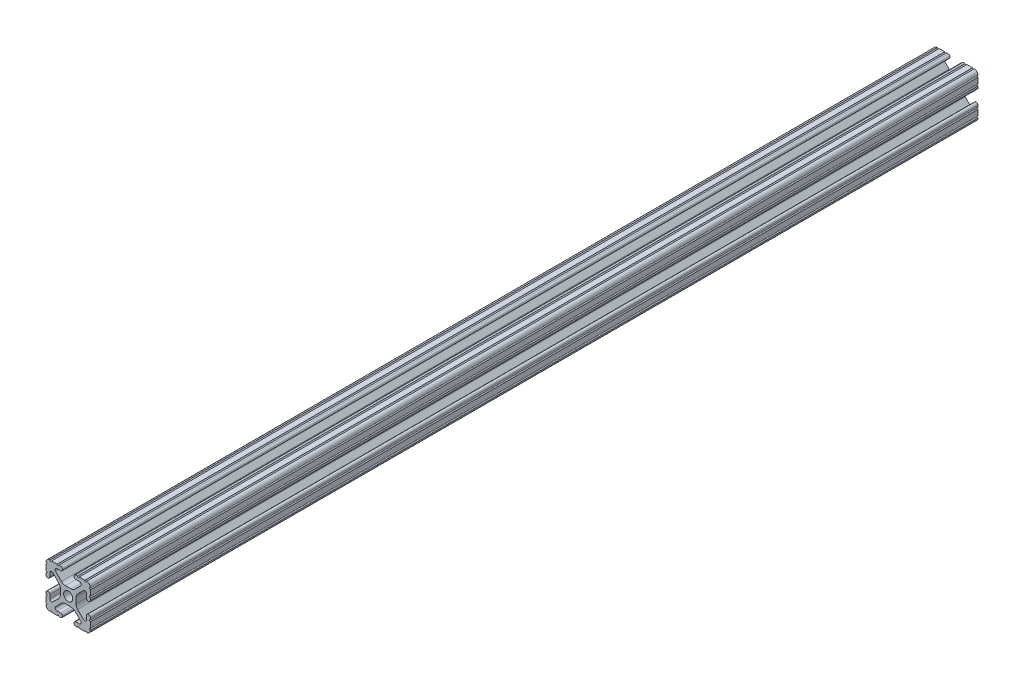
from build123d import *

# Parameters (mm, degrees)
SKETCH1_R           = 2.6035
BOSS_EXTRUDE1_DEPTH = 508


with BuildPart() as part:
    # Sketch1 → Boss-Extrude1 (new body)
    with BuildSketch(Plane(origin=(0, 0, -25.4), x_dir=(-1, 0, 0), z_dir=(0, 0, -1))):
        with BuildLine():
            Line((12.7, -9.5504), (12.7, -6.3330836))
            ThreePointArc((12.7, -6.3330836), (12.192, -5.8250836), (12.7, -5.3170836))
            Line((12.7, -5.3170836), (12.7, -4.3434))
            ThreePointArc((12.7, -4.3434), (11.5951, -3.2385), (10.4902, -4.3434))
            Line((10.4902, -4.3434), (10.4902, -6.474794456))
            ThreePointArc((10.4902, -6.474794456), (9.863006367, -7.413456061), (8.75577951, -7.193214945))
            Line((8.75577951, -7.193214945), (5.42573597, -3.863171405))
            ThreePointArc((5.42573597, -3.863171405), (4.737482484, -2.833127272), (4.4958, -1.618107374))
            Line((4.4958, -1.618107374), (4.4958, 1.618107374))
            ThreePointArc((4.4958, 1.618107374), (4.737482484, 2.833127272), (5.42573597, 3.863171405))
            Line((5.42573597, 3.863171405), (8.75577951, 7.193214945))
            ThreePointArc((8.75577951, 7.193214945), (9.863006367, 7.413456061), (10.4902, 6.474794456))
            Line((10.4902, 6.474794456), (10.4902, 4.343399971))
            ThreePointArc((10.4902, 4.343399971), (11.5951, 3.238499971), (12.7, 4.343399971))
            Line((12.7, 4.343399971), (12.7, 5.3170836))
            ThreePointArc((12.7, 5.3170836), (12.192, 5.8250836), (12.7, 6.3330836))
            Line((12.7, 6.3330836), (12.7, 9.5504))
            ThreePointArc((12.7, 9.5504), (12.192000006, 10.058323491), (12.699846982, 10.566399977))
            ThreePointArc((12.699846982, 10.566399977), (12.082522516, 12.082522516), (10.566399977, 12.699846982))
            ThreePointArc((10.566399977, 12.699846982), (10.058323491, 12.192000006), (9.5504, 12.7))
            Line((9.5504, 12.7), (6.3330836, 12.7))
            ThreePointArc((6.3330836, 12.7), (5.8250836, 12.192), (5.3170836, 12.7))
            Line((5.3170836, 12.7), (4.3434, 12.7))
            ThreePointArc((4.3434, 12.7), (3.2385, 11.5951), (4.3434, 10.4902))
            Line((4.3434, 10.4902), (6.474794456, 10.4902))
            ThreePointArc((6.474794456, 10.4902), (7.413456061, 9.863006367), (7.193214945, 8.75577951))
            Line((7.193214945, 8.75577951), (3.863171405, 5.42573597))
            ThreePointArc((3.863171405, 5.42573597), (2.833127272, 4.737482484), (1.618107374, 4.4958))
            Line((1.618107374, 4.4958), (-1.618107374, 4.4958))
            ThreePointArc((-1.618107374, 4.4958), (-2.833127272, 4.737482484), (-3.863171405, 5.42573597))
            Line((-3.863171405, 5.42573597), (-7.193214945, 8.75577951))
            ThreePointArc((-7.193214945, 8.75577951), (-7.413456061, 9.863006367), (-6.474794456, 10.4902))
            Line((-6.474794456, 10.4902), (-4.343399971, 10.4902))
            ThreePointArc((-4.343399971, 10.4902), (-3.238499971, 11.5951), (-4.343399971, 12.7))
            Line((-4.343399971, 12.7), (-5.3170836, 12.7))
            ThreePointArc((-5.3170836, 12.7), (-5.8250836, 12.192), (-6.3330836, 12.7))
            Line((-6.3330836, 12.7), (-9.5504, 12.7))
            ThreePointArc((-9.5504, 12.7), (-10.058323491, 12.192000006), (-10.566399977, 12.699846982))
            ThreePointArc((-10.566399977, 12.699846982), (-12.082522516, 12.082522516), (-12.699846982, 10.566399977))
            ThreePointArc((-12.699846982, 10.566399977), (-12.192000006, 10.058323491), (-12.7, 9.5504))
            Line((-12.7, 9.5504), (-12.7, 6.3330836))
            ThreePointArc((-12.7, 6.3330836), (-12.192, 5.8250836), (-12.7, 5.3170836))
            Line((-12.7, 5.3170836), (-12.7, 4.3434))
            ThreePointArc((-12.7, 4.3434), (-11.5951, 3.2385), (-10.4902, 4.3434))
            Line((-10.4902, 4.3434), (-10.4902, 6.474794456))
            ThreePointArc((-10.4902, 6.474794456), (-9.863006367, 7.413456061), (-8.75577951, 7.193214945))
            Line((-8.75577951, 7.193214945), (-5.42573597, 3.863171405))
            ThreePointArc((-5.42573597, 3.863171405), (-4.737482484, 2.833127272), (-4.4958, 1.618107374))
            Line((-4.4958, 1.618107374), (-4.4958, -1.618107374))
            ThreePointArc((-4.4958, -1.618107374), (-4.737482484, -2.833127272), (-5.42573597, -3.863171405))
            Line((-5.42573597, -3.863171405), (-8.75577951, -7.193214945))
            ThreePointArc((-8.75577951, -7.193214945), (-9.863006367, -7.413456061), (-10.4902, -6.474794456))
            Line((-10.4902, -6.474794456), (-10.4902, -4.343399971))
            ThreePointArc((-10.4902, -4.343399971), (-11.5951, -3.238499971), (-12.7, -4.343399971))
            Line((-12.7, -4.343399971), (-12.7, -5.3170836))
            ThreePointArc((-12.7, -5.3170836), (-12.192, -5.8250836), (-12.7, -6.3330836))
            Line((-12.7, -6.3330836), (-12.7, -9.5504))
            ThreePointArc((-12.7, -9.5504), (-12.192000006, -10.058323491), (-12.699846982, -10.566399977))
            ThreePointArc((-12.699846982, -10.566399977), (-12.082522516, -12.082522516), (-10.566399977, -12.699846982))
            ThreePointArc((-10.566399977, -12.699846982), (-10.058323491, -12.192000006), (-9.5504, -12.7))
            Line((-9.5504, -12.7), (-6.3330836, -12.7))
            ThreePointArc((-6.3330836, -12.7), (-5.8250836, -12.192), (-5.3170836, -12.7))
            Line((-5.3170836, -12.7), (-4.3434, -12.7))
            ThreePointArc((-4.3434, -12.7), (-3.2385, -11.5951), (-4.3434, -10.4902))
            Line((-4.3434, -10.4902), (-6.474794456, -10.4902))
            ThreePointArc((-6.474794456, -10.4902), (-7.413456061, -9.863006367), (-7.193214945, -8.75577951))
            Line((-7.193214945, -8.75577951), (-3.863171405, -5.42573597))
            ThreePointArc((-3.863171405, -5.42573597), (-2.833127272, -4.737482484), (-1.618107374, -4.4958))
            Line((-1.618107374, -4.4958), (1.618107374, -4.4958))
            ThreePointArc((1.618107374, -4.4958), (2.833127272, -4.737482484), (3.863171405, -5.42573597))
            Line((3.863171405, -5.42573597), (7.193214945, -8.75577951))
            ThreePointArc((7.193214945, -8.75577951), (7.413456061, -9.863006367), (6.474794456, -10.4902))
            Line((6.474794456, -10.4902), (4.343399971, -10.4902))
            ThreePointArc((4.343399971, -10.4902), (3.238499971, -11.5951), (4.343399971, -12.7))
            Line((4.343399971, -12.7), (5.3170836, -12.7))
            ThreePointArc((5.3170836, -12.7), (5.8250836, -12.192), (6.3330836, -12.7))
            Line((6.3330836, -12.7), (9.5504, -12.7))
            ThreePointArc((9.5504, -12.7), (10.058323491, -12.192000006), (10.566399977, -12.699846982))
            ThreePointArc((10.566399977, -12.699846982), (12.082522516, -12.082522516), (12.699846982, -10.566399977))
            ThreePointArc((12.699846982, -10.566399977), (12.192000006, -10.058323491), (12.7, -9.5504))
        make_face()
        with Locations(Location((0, 0, 0), (0, 0, 180))):
            Circle(SKETCH1_R, mode=Mode.SUBTRACT)
    extrude(amount=-BOSS_EXTRUDE1_DEPTH)


solid = part.part
